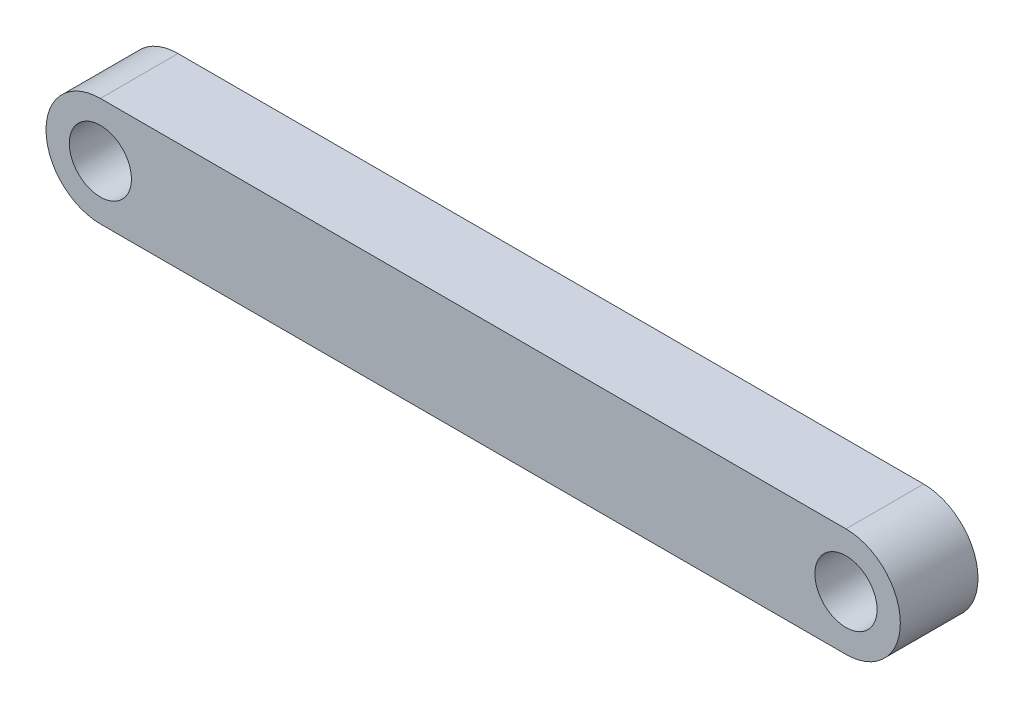
from build123d import *

# Parameters (mm, degrees)
SKETCH1_R           = 25.4
BOSS_EXTRUDE1_DEPTH = 31.75


with BuildPart() as part:
    # Sketch1 → Boss-Extrude1 (new, symmetric)
    with BuildSketch(Plane.XY):
        with BuildLine():
            Line((609.6, -44.45), (0, -44.45))
            ThreePointArc((0, -44.45), (-44.45, 0), (0, 44.45))
            Line((0, 44.45), (609.6, 44.45))
            ThreePointArc((609.6, 44.45), (654.05, 0), (609.6, -44.45))
        make_face()
        with Locations((609.6, 0)):
            Circle(SKETCH1_R, mode=Mode.SUBTRACT)
        Circle(SKETCH1_R, mode=Mode.SUBTRACT)
    extrude(amount=BOSS_EXTRUDE1_DEPTH, both=True)


solid = part.part
